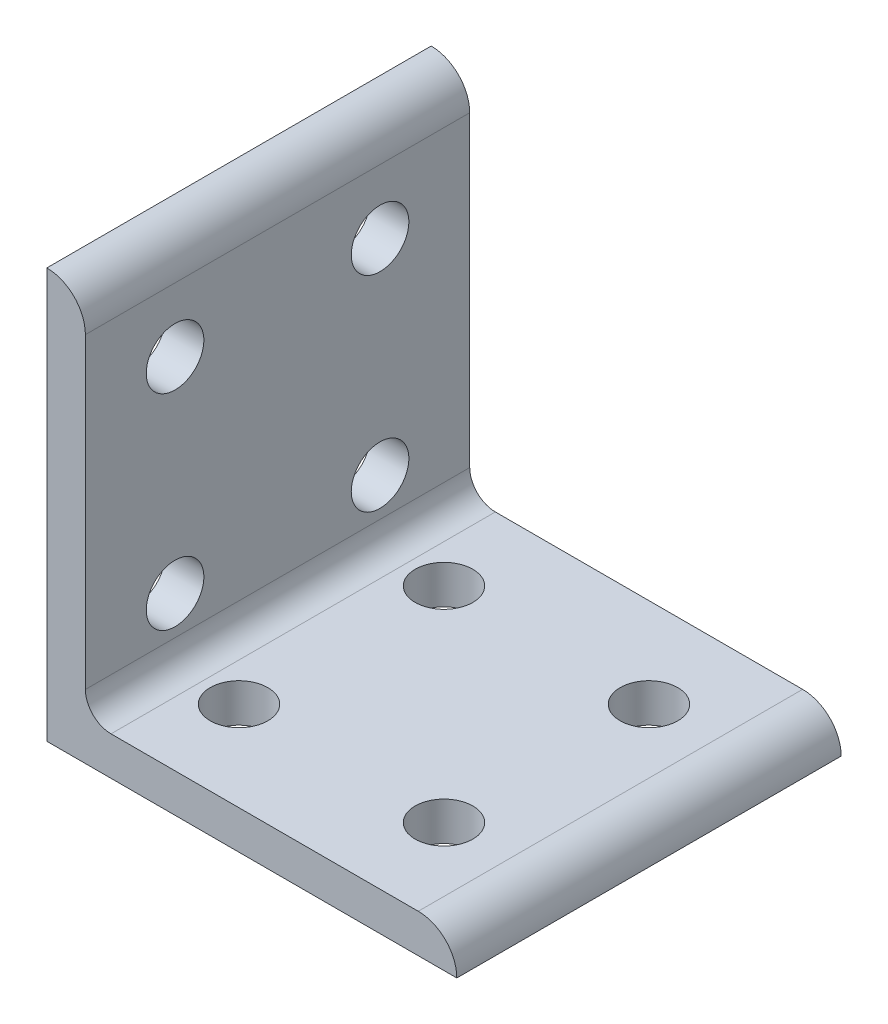
from build123d import *

# Parameters (mm, degrees)
BOSS_EXTRUDE1_DEPTH = 23.8125
SKETCH2_R           = 3.5687
CUT_EXTRUDE1_DEPTH  = 76.685633751
SKETCH3_R           = 3.5687
CUT_EXTRUDE2_DEPTH  = 76.685633751


with BuildPart() as part:
    # Sketch1 → Boss-Extrude1 (new, symmetric)
    with BuildSketch(Plane.XY):
        with BuildLine():
            Line((0, 0), (0, 50.8))
            ThreePointArc((0, 50.8), (3.376576302, 49.401376302), (4.7752, 46.0248))
            Line((4.7752, 46.0248), (4.7752, 7.9502))
            ThreePointArc((4.7752, 7.9502), (5.70513597, 5.70513597), (7.9502, 4.7752))
            Line((7.9502, 4.7752), (46.0248, 4.7752))
            ThreePointArc((46.0248, 4.7752), (49.401376302, 3.376576302), (50.8, 0))
            Line((50.8, 0), (0, 0))
        make_face()
    extrude(amount=BOSS_EXTRUDE1_DEPTH, both=True)

    # Sketch2 → Cut-Extrude1 (cut, through all)
    with BuildSketch(Plane(origin=(0, 0, 0), x_dir=(1, 0, 0), z_dir=(0, 1, 0))):
        with Locations(Location((12.7, -12.7, 0), (0, 0, 90))):
            Circle(SKETCH2_R)
        with Locations(Location((38.1, -12.7, 0), (0, 0, 90))):
            Circle(SKETCH2_R)
        with Locations(Location((12.7, 12.7, 0), (0, 0, 90))):
            Circle(SKETCH2_R)
        with Locations(Location((38.1, 12.7, 0), (0, 0, 90))):
            Circle(SKETCH2_R)
    extrude(amount=CUT_EXTRUDE1_DEPTH, mode=Mode.SUBTRACT)

    # Sketch3 → Cut-Extrude2 (cut, through all)
    with BuildSketch(Plane(origin=(0, 0, 0), x_dir=(0, 0, -1), z_dir=(1, 0, 0))):
        with Locations(Location((-12.7, 12.7, 0), (0, 0, 180))):
            Circle(SKETCH3_R)
        with Locations(Location((-12.7, 38.1, 0), (0, 0, 180))):
            Circle(SKETCH3_R)
        with Locations(Location((12.7, 12.7, 0), (0, 0, 180))):
            Circle(SKETCH3_R)
        with Locations(Location((12.7, 38.1, 0), (0, 0, 180))):
            Circle(SKETCH3_R)
    extrude(amount=CUT_EXTRUDE2_DEPTH, mode=Mode.SUBTRACT)


solid = part.part
